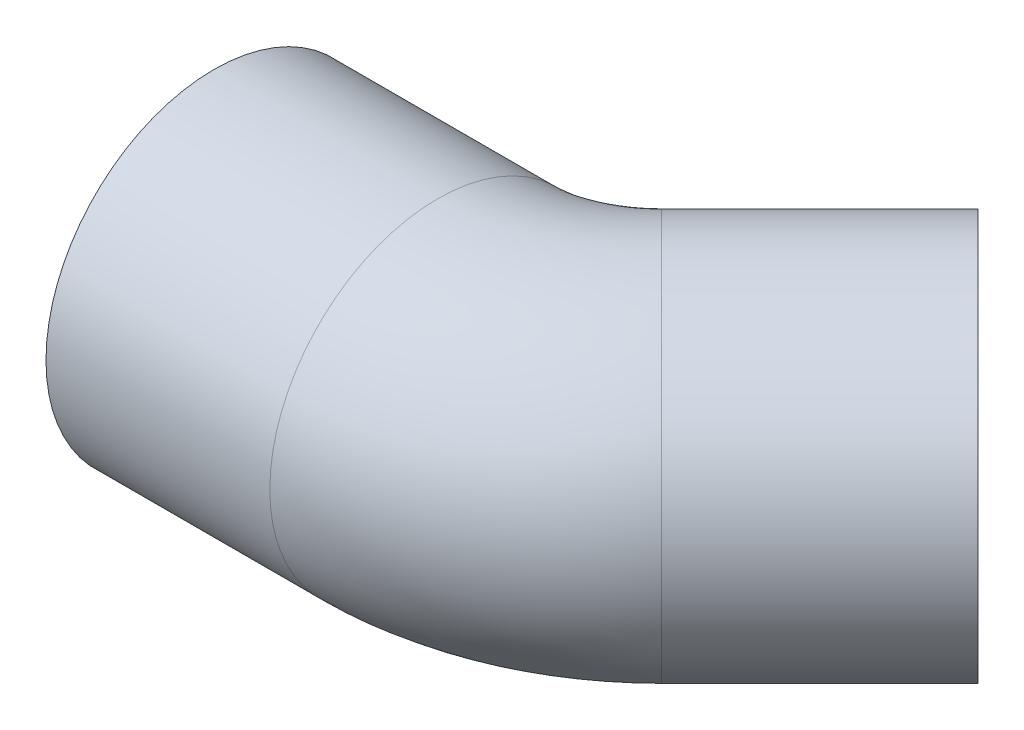
from build123d import *

# Parameters (mm, degrees)
SKETCH2_R = 9.525


with BuildPart() as part:
    # Sweep1: sweep along a path in Sketch1
    with BuildLine(Plane(origin=(0, 0, 0), x_dir=(1, 0, 0), z_dir=(0, 1, 0))) as sweep1_path:
        Line((0, 0), (12.7, 0))
        ThreePointArc((12.7, 0), (17.560079591, 0.966729937), (21.680256121, 3.719743879))
        Line((21.680256121, 3.719743879), (30.660512242, 12.7))
    # Sketch2 → Sweep1 (sweep)
    with BuildSketch(Plane(origin=(0, 0, 0), x_dir=(0, 0, -1), z_dir=(1, 0, 0))):
        Circle(SKETCH2_R)
    sweep(path=sweep1_path.line)


solid = part.part
